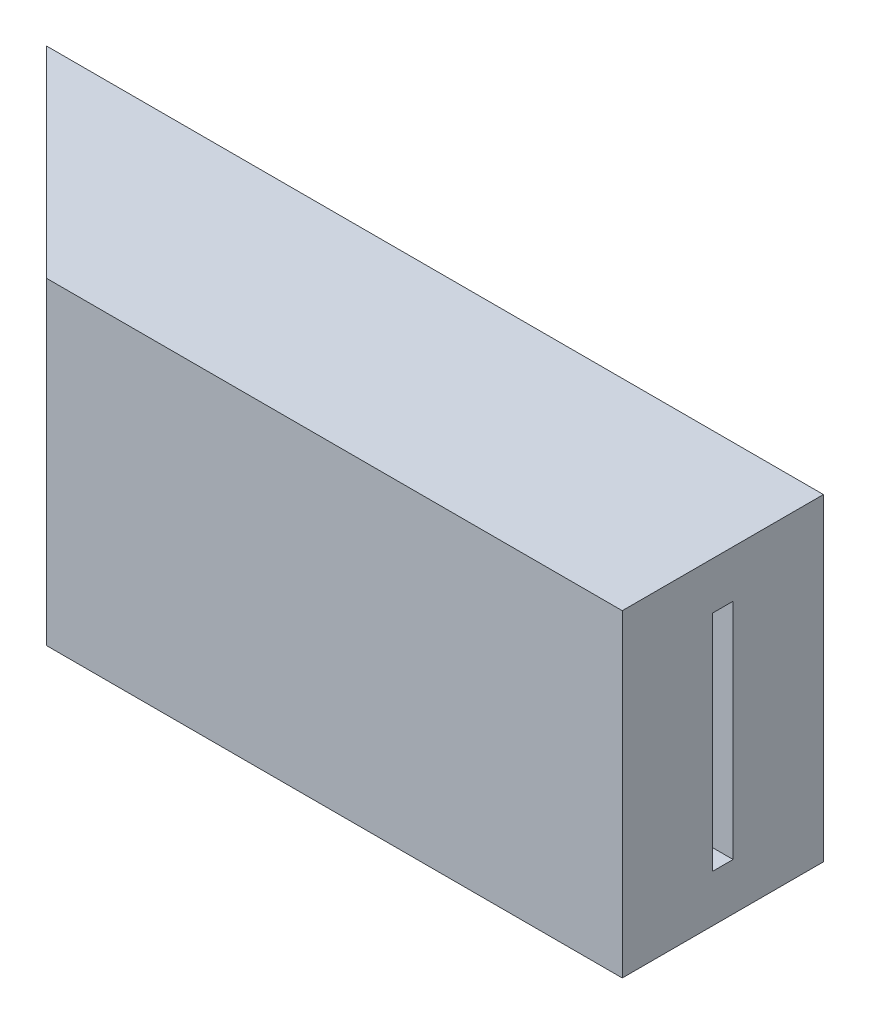
from build123d import *

# Parameters (mm, degrees)
SALIENTE_EXTRUIR1_DEPTH = 37.5285
CORTAR_EXTRUIR1_DEPTH   = 18.4023
SALIENTE_EXTRUIR2_DEPTH = 15.0114
SALIENTE_EXTRUIR3_DEPTH = 53.975
CORTAR_EXTRUIR2_DEPTH   = 17.1323
CROQUIS6_W              = 24.9936
CROQUIS6_H              = 37.5285
CROQUIS6_W_2            = 2.54
CROQUIS6_H_2            = 27.79
SALIENTE_EXTRUIR4_DEPTH = 2.54
SALIENTE_EXTRUIR5_DEPTH = 1.9939
SALIENTE_EXTRUIR6_DEPTH = 17.1323
SALIENTE_EXTRUIR7_DEPTH = 18.683041561
SALIENTE_EXTRUIR8_DEPTH = 19.015985732
SALIENTE_EXTRUIR9_DEPTH = 17.1323
CHAFL_N1_SIZE           = 2.54


with BuildPart() as part:
    # Croquis1 → Saliente-Extruir1 (new body)
    with BuildSketch(Plane(origin=(0, 19.7612, 0), x_dir=(1, 0, 0), z_dir=(0, 1, 0))):
        Polygon((0, 12.4968), (24.9936, -12.4968), (24.9936, 12.4968), align=None)
    extrude(amount=-SALIENTE_EXTRUIR1_DEPTH)

    # Croquis2 → Cortar-Extruir1 (cut)
    with BuildSketch(Plane.XZ.offset(17.7673)):
        Polygon((24.9936, -10.5029), (24.9936, 10.5029), (22.9997, 10.5029), (1.9939, -10.5029), align=None)
    extrude(amount=-CORTAR_EXTRUIR1_DEPTH, mode=Mode.SUBTRACT)

    # Croquis3 → Saliente-Extruir2 (add)
    with BuildSketch(Plane(origin=(24.9936, 0, 0), x_dir=(0, 0, -1), z_dir=(1, 0, 0))):
        Polygon((10.5029, -17.7673), (10.5029, 0.635), (-10.5029, 0.635), (-10.5029, -17.7673), (-12.4968, -17.7673), (-12.4968, 19.7612), (12.4968, 19.7612), (12.4968, -17.7673), align=None)
    extrude(amount=SALIENTE_EXTRUIR2_DEPTH)

    # Croquis4 → Saliente-Extruir3 (add)
    with BuildSketch(Plane(origin=(40.005, 0, 0), x_dir=(0, 0, -1), z_dir=(1, 0, 0))):
        Polygon((10.5029, 1.469986946), (-10.5029, 1.469986946), (-10.5029, -17.7673), (-12.4968, -17.7673), (-12.4968, 19.7612), (12.4968, 19.7612), (12.4968, -17.7673), (10.5029, -17.7673), align=None)
    extrude(amount=SALIENTE_EXTRUIR3_DEPTH)

    # Croquis5 → Cortar-Extruir2 (cut)
    with BuildSketch(Plane.XZ.offset(-0.635)):
        Polygon((93.98, -10.5029), (93.98, 10.5029), (22.9997, 10.5029), (1.9939, -10.5029), align=None)
    extrude(amount=-CORTAR_EXTRUIR2_DEPTH, mode=Mode.SUBTRACT)

    # Croquis6 → Saliente-Extruir4 (add)
    with BuildSketch(Plane(origin=(93.98, 0, 0), x_dir=(0, 0, -1), z_dir=(1, 0, 0))):
        with Locations((0, 0.99695)):
            Rectangle(CROQUIS6_W, CROQUIS6_H)
        with Locations((0, 0.0012)):
            Rectangle(CROQUIS6_W_2, CROQUIS6_H_2, mode=Mode.SUBTRACT)
    extrude(amount=SALIENTE_EXTRUIR4_DEPTH)

    # Croquis7 → Saliente-Extruir5 (add)
    with BuildSketch(Plane.XZ.offset(17.7673)):
        Polygon((24.9936, 12.4968), (96.52, 12.4968), (96.52, -12.4968), (0, -12.4968), align=None)
    extrude(amount=SALIENTE_EXTRUIR5_DEPTH)

    # Croquis8 → Saliente-Extruir6 (add)
    with BuildSketch(Plane(origin=(0, -17.7673, 0), x_dir=(-1, 0, 0), z_dir=(0, 1, 0))):
        Polygon((-65.405, -4.138152009), (-65.405, -10.5029), (-68.58, -10.5029), (-68.58, -3.819468452), align=None)
    extrude(amount=SALIENTE_EXTRUIR6_DEPTH)

    # Croquis9 → Saliente-Extruir7 (add)
    with BuildSketch(Plane.XZ.offset(-17.7673)):
        Polygon((65.405, 10.5029), (68.58, 10.5029), (68.58, 4.573954196), (65.405, 4.98694847), align=None)
    extrude(amount=SALIENTE_EXTRUIR7_DEPTH)

    # Croquis10 → Saliente-Extruir8 (add)
    with BuildSketch(Plane.XZ.offset(-17.7673)):
        Polygon((68.58, -3.819468452), (68.58, -10.5029), (65.405, -10.5029), (65.405, -4.138152009), align=None)
    extrude(amount=SALIENTE_EXTRUIR8_DEPTH)

    # Croquis11 → Saliente-Extruir9 (add)
    with BuildSketch(Plane(origin=(0, -17.7673, 0), x_dir=(-1, 0, 0), z_dir=(0, 1, 0))):
        Polygon((-68.58, 10.5029), (-65.405, 10.5029), (-65.405, 4.98694847), (-68.58, 4.573954196), align=None)
    extrude(amount=SALIENTE_EXTRUIR9_DEPTH)

    # Chaflán1
    chafl_n1_edges = [part.edges().sort_by_distance(p)[0] for p in [
        (81.28, -17.7673, -10.5029),
        (44.20235, 17.7673, 10.5029),
        (81.28, 17.7673, -10.5029),
        (33.69945, -17.7673, -10.5029),
        (81.28, -17.7673, 10.5029),
        (44.20235, -17.7673, 10.5029),
        (33.69945, 17.7673, -10.5029),
        (81.28, 17.7673, 10.5029),
    ]]
    chamfer(chafl_n1_edges, length=CHAFL_N1_SIZE)


solid = part.part
